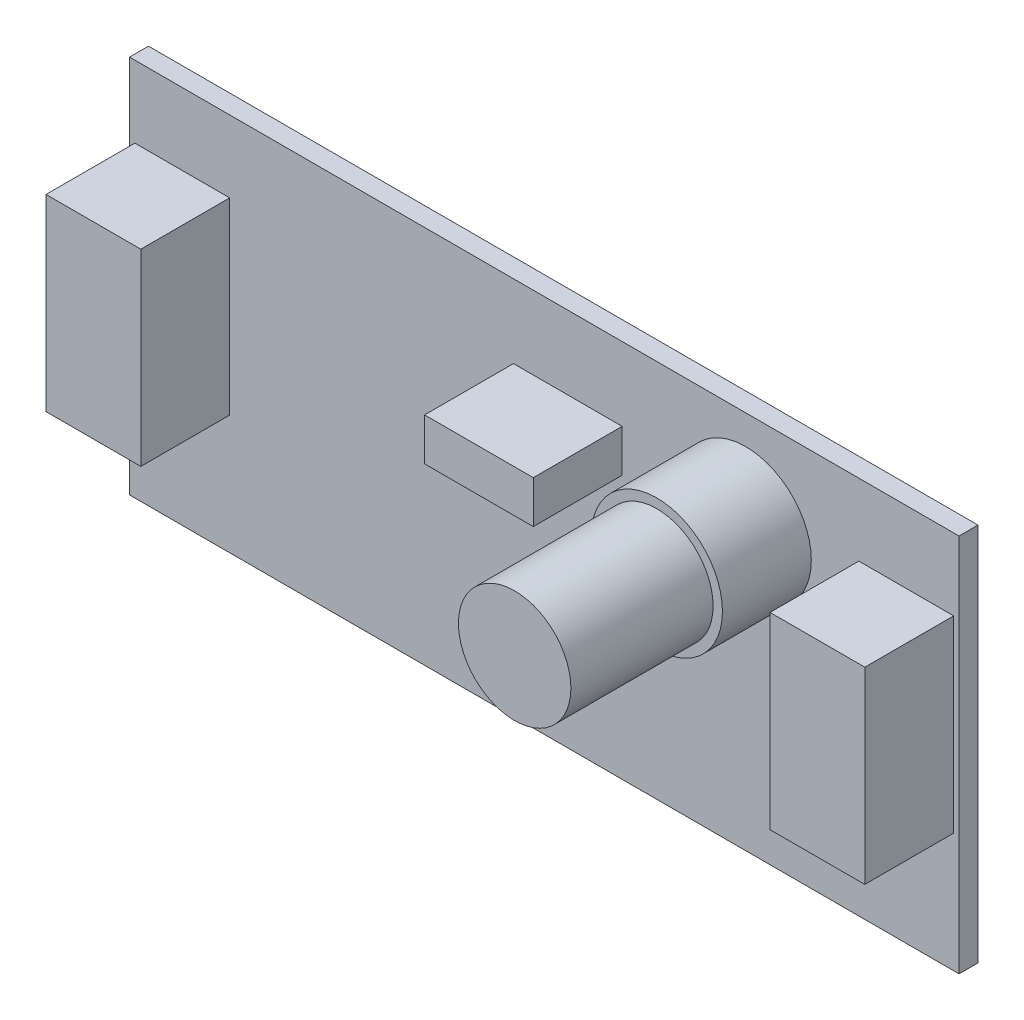
from build123d import *

# Parameters (mm, degrees)
SKETCH2_W           = 69.99986
SKETCH2_H           = 31.999936
BOSS_EXTRUDE1_DEPTH = 1.6
SKETCH3_R           = 5.533230125
SKETCH3_W           = 8.0009746
SKETCH3_H           = 15.8759652
SKETCH3_W_2         = 9.1719654
SKETCH3_H_2         = 3.5780218
BOSS_EXTRUDE2_DEPTH = 7.5
SKETCH4_R           = 4.745015856
BOSS_EXTRUDE3_DEPTH = 12


with BuildPart() as part:
    # Sketch2 → Boss-Extrude1 (new body)
    with BuildSketch(Plane.XY):
        with Locations((34.99993, 15.999968)):
            Rectangle(SKETCH2_W, SKETCH2_H)
    extrude(amount=-BOSS_EXTRUDE1_DEPTH)

    # Sketch3 → Boss-Extrude2 (add)
    with BuildSketch(Plane.XY):
        with Locations((51.999892991, 23.999962155)):
            Circle(SKETCH3_R)
        with Locations((65.5473543, 17.999964)):
            Rectangle(SKETCH3_W, SKETCH3_H)
        with Locations((4.4525057, 17.999964)):
            Rectangle(SKETCH3_W, SKETCH3_H)
        with Locations((36.9859433, 24.0110899)):
            Rectangle(SKETCH3_W_2, SKETCH3_H_2)
    extrude(amount=BOSS_EXTRUDE2_DEPTH)

    # Sketch4 → Boss-Extrude3 (add)
    with BuildSketch(Plane.XY.offset(7.5)):
        with Locations((51.999892991, 23.999962155)):
            Circle(SKETCH4_R)
    extrude(amount=BOSS_EXTRUDE3_DEPTH)


solid = part.part
